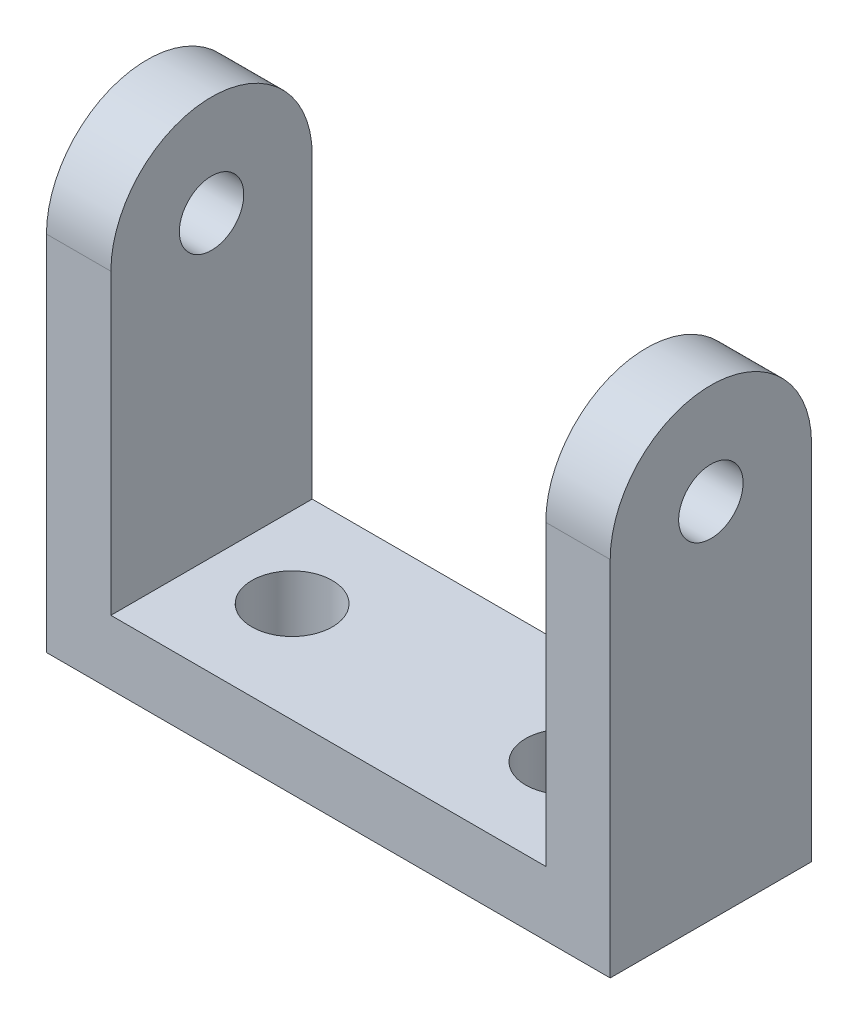
from build123d import *

# Parameters (mm, degrees)
BOSS_EXTRUDE1_DEPTH = 25
BOSS_EXTRUDE2_START = -8
BOSS_EXTRUDE2_DEPTH = 8
CUT_EXTRUDE1_DEPTH  = 8
BOSS_EXTRUDE3_DEPTH = 8
CUT_EXTRUDE2_START  = -8
CUT_EXTRUDE2_DEPTH  = 8
SKETCH6_R           = 5
CUT_EXTRUDE3_DEPTH  = 66.576291447


with BuildPart() as part:
    # Sketch1 → Boss-Extrude1 (new body)
    with BuildSketch(Plane.XY):
        Polygon((0, 0), (35, 0), (35, 45), (27, 45), (27, 8), (0, 8), (-27, 8), (-27, 45), (-35, 45), (-35, 0), align=None)
    extrude(amount=BOSS_EXTRUDE1_DEPTH)

    # Sketch2 → Boss-Extrude2 (add)
    with BuildSketch(Plane(origin=(35, 0, 0), x_dir=(0, 0, -1), z_dir=(1, 0, 0)).offset(BOSS_EXTRUDE2_START)):
        with BuildLine():
            ThreePointArc((-25, 45), (-12.5, 57.5), (0, 45))
            Line((0, 45), (-25, 45))
        make_face()
    extrude(amount=BOSS_EXTRUDE2_DEPTH)

    # Sketch3 → Cut-Extrude1 (cut)
    with BuildSketch(Plane(origin=(35, 0, 0), x_dir=(0, 0, -1), z_dir=(1, 0, 0))):
        with BuildLine():
            ThreePointArc((-16.5, 45), (-12.5, 41), (-8.5, 45))
            Line((-8.5, 45), (-16.5, 45))
        make_face()
        with BuildLine():
            Line((-16.5, 45), (-8.5, 45))
            ThreePointArc((-8.5, 45), (-12.5, 49), (-16.5, 45))
        make_face()
    extrude(amount=-CUT_EXTRUDE1_DEPTH, mode=Mode.SUBTRACT)

    # Sketch4 → Boss-Extrude3 (add)
    with BuildSketch(Plane.ZY.offset(35)):
        with BuildLine():
            ThreePointArc((0, 45), (12.5, 57.5), (25, 45))
            Line((25, 45), (0, 45))
        make_face()
    extrude(amount=-BOSS_EXTRUDE3_DEPTH)

    # Sketch5 → Cut-Extrude2 (cut)
    with BuildSketch(Plane.ZY.offset(35).offset(CUT_EXTRUDE2_START)):
        with BuildLine():
            ThreePointArc((8.5, 45), (12.5, 41), (16.5, 45))
            Line((16.5, 45), (8.5, 45))
        make_face()
        with BuildLine():
            Line((8.5, 45), (16.5, 45))
            ThreePointArc((16.5, 45), (12.5, 49), (8.5, 45))
        make_face()
    extrude(amount=CUT_EXTRUDE2_DEPTH, mode=Mode.SUBTRACT)

    # Sketch6 → Cut-Extrude3 (cut, through all)
    with BuildSketch(Plane(origin=(0, 8, 0), x_dir=(1, 0, 0), z_dir=(0, 1, 0))):
        with Locations(Location((-17, -12.5, 0), (0, 0, 270))):
            Circle(SKETCH6_R)
        with Locations(Location((17, -12.5, 0), (0, 0, 270))):
            Circle(SKETCH6_R)
    extrude(amount=-CUT_EXTRUDE3_DEPTH, mode=Mode.SUBTRACT)


solid = part.part
